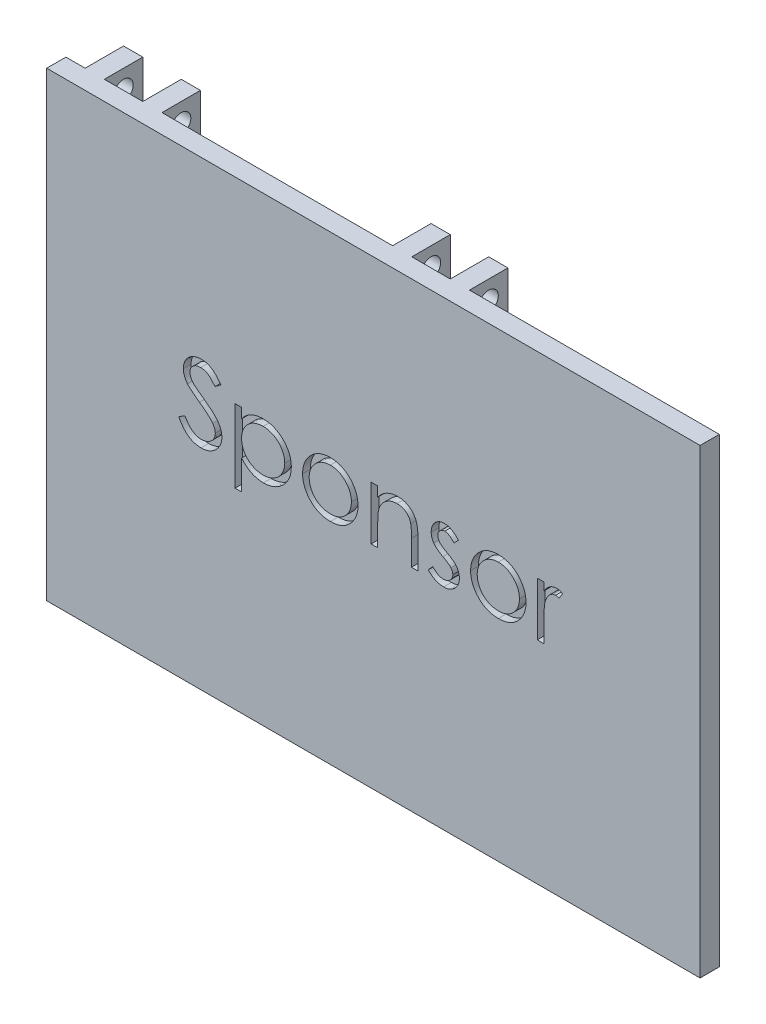
from build123d import *

# Parameters (mm, degrees)
ESQUISSE1_W             = 170
ESQUISSE1_H             = 120
BASE_DEPTH              = 5
ESQUISSE2_W             = 5
ESQUISSE2_H             = 10
BOSS_TIGE_DEPTH         = 10
VIDE_SPONSOR_DEPTH      = 2
ESQUISSE5_R             = 2.5
ENL_V_MAT_EXTRU_3_DEPTH = 122.346611131


with BuildPart() as part:
    # Esquisse1 → BASE (new body)
    with BuildSketch(Plane.XY):
        Rectangle(ESQUISSE1_W, ESQUISSE1_H)
    extrude(amount=BASE_DEPTH)

    # Esquisse2 → BOSS TIGE (add)
    with BuildSketch(Plane(origin=(0, 60, 0), x_dir=(1, 0, 0), z_dir=(0, 1, 0))):
        with Locations((17.5, 5)):
            Rectangle(ESQUISSE2_W, ESQUISSE2_H)
        with Locations((2.5, 5)):
            Rectangle(ESQUISSE2_W, ESQUISSE2_H)
        with Locations((-62.5, 5)):
            Rectangle(ESQUISSE2_W, ESQUISSE2_H)
        with Locations((-77.5, 5)):
            Rectangle(ESQUISSE2_W, ESQUISSE2_H)
    extrude(amount=-BOSS_TIGE_DEPTH)

    # Esquisse4 → VIDE SPONSOR (cut)
    # profile 1 of 7: a face of its own
    with BuildSketch(Plane.XY.offset(5)):
        with BuildLine():
            Line((-50.657804234, -1.320890287), (-49.0474076, -0.355415527))
            add(Edge.make_bspline(
                [(-49.0474076, -0.355415527), (-48.897629765, -0.606137394), (-48.610661215, -1.086510815), (-48.131954532, -1.735615292), (-47.635931115, -2.287315031), (-47.118917743, -2.738400566), (-46.584070225, -3.093540935), (-46.027897018, -3.345013082), (-45.452272363, -3.50185432), (-45.060529134, -3.520904791), (-44.864955676, -3.530415527)],
                knots=[0, 0, 0, 0, 1.272034388, 2.437168799, 3.508375237, 4.49857839, 5.41946034, 6.295179144, 7.148887113, 8, 8, 8, 8], degree=3))
            add(Edge.make_bspline(
                [(-44.864955676, -3.530415527), (-44.697931479, -3.525763667), (-44.366805614, -3.516541342), (-43.87933112, -3.427927263), (-43.405901596, -3.291789818), (-42.956274582, -3.096821605), (-42.536654166, -2.860936419), (-42.168680581, -2.576023653), (-41.850566737, -2.257038447), (-41.590348556, -1.901169998), (-41.390704364, -1.518443804), (-41.237258963, -1.125600411), (-41.152105062, -0.716468633), (-41.13927759, -0.441003113), (-41.132804234, -0.301990046)],
                knots=[0, 0, 0, 0, 1.095163259, 2.171163733, 3.241058638, 4.321873601, 5.38011039, 6.391990106, 7.366004449, 8.327778327, 9.272591725, 10.192022065, 11.087607919, 12, 12, 12, 12], degree=3))
            add(Edge.make_bspline(
                [(-41.132804234, -0.301990046), (-41.140828697, -0.143380564), (-41.157141256, 0.179049335), (-41.295016884, 0.654753161), (-41.511910641, 1.125519863), (-41.712004459, 1.416719609), (-41.815887167, 1.567901781)],
                knots=[0, 0, 0, 0, 0.938893495, 1.908633276, 2.914225137, 4, 4, 4, 4], degree=3))
            add(Edge.make_bspline(
                [(-41.815887167, 1.567901781), (-41.901180081, 1.677013778), (-42.080241886, 1.906080767), (-42.388076347, 2.247049834), (-42.749297626, 2.598758658), (-43.151544118, 2.974637239), (-43.609468502, 3.357203675), (-44.108728259, 3.764701017), (-44.66207012, 4.181632457), (-45.050143094, 4.461245993), (-45.250382359, 4.605521973)],
                knots=[0, 0, 0, 0, 0.722233717, 1.516239348, 2.393582979, 3.351407094, 4.387010283, 5.505090956, 6.712668013, 8, 8, 8, 8], degree=3))
            add(Edge.make_bspline(
                [(-45.250382359, 4.605521973), (-45.45081011, 4.748280428), (-45.834012707, 5.021223724), (-46.369908705, 5.42630447), (-46.849122139, 5.796657532), (-47.269523072, 6.135769369), (-47.630926592, 6.443685975), (-47.936180586, 6.717450472), (-48.177509018, 6.96446671), (-48.311705822, 7.124711728), (-48.371956878, 7.19665779)],
                knots=[0, 0, 0, 0, 1.452282411, 2.77665338, 3.964542531, 5.026858415, 5.96415736, 6.766646006, 7.446254459, 8, 8, 8, 8], degree=3))
            add(Edge.make_bspline(
                [(-48.371956878, 7.19665779), (-48.456171732, 7.308786291), (-48.621791543, 7.529302036), (-48.840409373, 7.87397019), (-49.026223959, 8.226793963), (-49.171887509, 8.588721455), (-49.294548929, 8.954671568), (-49.377051381, 9.329419062), (-49.428711698, 9.7112824), (-49.434002082, 9.968258739), (-49.436650388, 10.096898175)],
                knots=[0, 0, 0, 0, 1.068054152, 2.10047183, 3.106115577, 4.101338837, 5.06977816, 6.043150881, 7.020423561, 8, 8, 8, 8], degree=3))
            add(Edge.make_bspline(
                [(-49.436650388, 10.096898175), (-49.429546322, 10.298445948), (-49.415490034, 10.697233552), (-49.296615219, 11.279787072), (-49.108984183, 11.835973143), (-48.846122008, 12.360285388), (-48.50726413, 12.839071655), (-48.115128184, 13.277839349), (-47.648068523, 13.64669406), (-47.135609245, 13.968976835), (-46.574688134, 14.221231085), (-45.986909074, 14.411518706), (-45.371337868, 14.519337666), (-44.954397949, 14.534810429), (-44.742840292, 14.542661396)],
                knots=[0, 0, 0, 0, 1.005424448, 1.989358655, 2.955360095, 3.929531133, 4.905563448, 5.876582895, 6.856512386, 7.866279853, 8.892233794, 9.918561126, 10.94386622, 12, 12, 12, 12], degree=3))
            add(Edge.make_bspline(
                [(-44.742840292, 14.542661396), (-44.518354546, 14.534918651), (-44.071924046, 14.519520802), (-43.415247601, 14.385639953), (-42.783001416, 14.164112011), (-42.274403075, 13.912713744), (-41.876351902, 13.661627038), (-41.572788885, 13.432919138), (-41.265172474, 13.169620332), (-40.951021347, 12.871029293), (-40.635658615, 12.534406262), (-40.314402397, 12.162056655), (-39.986501448, 11.756255973), (-39.775558838, 11.466562618), (-39.667419619, 11.318052021)],
                knots=[0, 0, 0, 0, 1.286793592, 2.559021753, 3.825965368, 5.121522368, 5.803751409, 6.523245864, 7.299691795, 8.125521123, 9.008227632, 9.944561021, 10.946284179, 12, 12, 12, 12], degree=3))
            Line((-39.667419619, 11.318052021), (-41.212942455, 10.14650755))
            add(Edge.make_bspline(
                [(-41.212942455, 10.14650755), (-41.306265316, 10.266733136), (-41.485983327, 10.498259506), (-41.758830963, 10.822497667), (-42.015998603, 11.118678791), (-42.269365779, 11.375936131), (-42.505551116, 11.608357742), (-42.734788161, 11.807347276), (-42.953777987, 11.974854445), (-43.229822886, 12.15361725), (-43.576629324, 12.330817648), (-44.011973729, 12.480763344), (-44.466921883, 12.570870181), (-44.776781734, 12.582783984), (-44.93364558, 12.588815242)],
                knots=[0, 0, 0, 0, 1.181633172, 2.275549214, 3.290209073, 4.226197932, 5.078386478, 5.862611352, 6.581680152, 7.217281963, 8.414376989, 9.595101626, 10.782541182, 12, 12, 12, 12], degree=3))
            add(Edge.make_bspline(
                [(-44.93364558, 12.588815242), (-45.130440367, 12.582220133), (-45.509940573, 12.569502085), (-46.048730287, 12.43060045), (-46.533655793, 12.211896325), (-46.950320469, 11.905381944), (-47.29723173, 11.542229113), (-47.548177155, 11.124332773), (-47.699217336, 10.662874267), (-47.717648373, 10.340974681), (-47.727035003, 10.177036396)],
                knots=[0, 0, 0, 0, 1.14458467, 2.207223713, 3.21896685, 4.227309161, 5.202851033, 6.127160689, 7.046193047, 8, 8, 8, 8], degree=3))
            add(Edge.make_bspline(
                [(-47.727035003, 10.177036396), (-47.724895271, 10.074974777), (-47.720612308, 9.870684649), (-47.660878052, 9.56887048), (-47.584137419, 9.267818762), (-47.462529666, 8.968882989), (-47.294643085, 8.666835121), (-47.074179199, 8.356473949), (-46.796521029, 8.035063935), (-46.583830433, 7.826018086), (-46.471536205, 7.715648175)],
                knots=[0, 0, 0, 0, 0.858281714, 1.717966888, 2.583508476, 3.4729293, 4.427298488, 5.488583878, 6.674047936, 8, 8, 8, 8], degree=3))
            add(Edge.make_bspline(
                [(-46.471536205, 7.715648175), (-46.42983645, 7.67843522), (-46.330767376, 7.590025758), (-46.149651266, 7.445287773), (-45.910476892, 7.26674697), (-45.619489769, 7.045836004), (-45.271324557, 6.789578332), (-44.865942973, 6.501250528), (-44.407863773, 6.17149253), (-44.082805916, 5.940946488), (-43.910929234, 5.819043608)],
                knots=[0, 0, 0, 0, 0.420754252, 0.999615792, 1.744751191, 2.668019286, 3.750313428, 4.999500688, 6.413464383, 8, 8, 8, 8], degree=3))
            add(Edge.make_bspline(
                [(-43.910929234, 5.819043608), (-43.704177335, 5.668595636), (-43.303830936, 5.377273992), (-42.73419468, 4.939582933), (-42.217701239, 4.511514364), (-41.752537231, 4.09580196), (-41.3341072, 3.695599054), (-40.967053321, 3.306090887), (-40.647635546, 2.930067984), (-40.303760086, 2.447980108), (-39.952381097, 1.855900206), (-39.650620892, 1.130485793), (-39.460347601, 0.402251535), (-39.435465495, -0.08720739), (-39.42318885, -0.328702787)],
                knots=[0, 0, 0, 0, 1.163667725, 2.253281268, 3.268753668, 4.215851969, 5.092017293, 5.902905408, 6.650798638, 7.335211899, 8.59617414, 9.77448103, 10.901945474, 12, 12, 12, 12], degree=3))
            add(Edge.make_bspline(
                [(-39.42318885, -0.328702787), (-39.426765558, -0.499490745), (-39.433849519, -0.837750076), (-39.515279635, -1.334438423), (-39.634585242, -1.816843585), (-39.814402186, -2.27900264), (-40.033875376, -2.729370562), (-40.312365954, -3.156133563), (-40.635169209, -3.568736961), (-41.005467273, -3.956178535), (-41.410665684, -4.311848545), (-41.838929793, -4.628236722), (-42.290960565, -4.892042883), (-42.764305803, -5.107312466), (-43.259074235, -5.275679183), (-43.775099459, -5.397669228), (-44.313232084, -5.472539597), (-44.678994705, -5.480310699), (-44.864955676, -5.484261681)],
                knots=[0, 0, 0, 0, 0.983748083, 1.948392443, 2.894712957, 3.844097841, 4.80183111, 5.778335162, 6.776009319, 7.81870978, 8.863265674, 9.881300176, 10.883814829, 11.87499822, 12.874611388, 13.892143829, 14.928324115, 16, 16, 16, 16], degree=3))
            add(Edge.make_bspline(
                [(-44.864955676, -5.484261681), (-45.008839472, -5.481479392), (-45.294794994, -5.475949856), (-45.717756603, -5.427066029), (-46.13217351, -5.35790308), (-46.532845531, -5.248098499), (-46.924934871, -5.11487381), (-47.306736248, -4.950835171), (-47.678434698, -4.754254403), (-48.042113256, -4.529491483), (-48.396846978, -4.267920045), (-48.739308653, -3.9632643), (-49.080734649, -3.623926623), (-49.411047477, -3.240691985), (-49.736928448, -2.819751848), (-50.051952363, -2.357167864), (-50.362639998, -1.855459696), (-50.557578473, -1.502408301), (-50.657804234, -1.320890287)],
                knots=[0, 0, 0, 0, 0.915332311, 1.819136955, 2.706846663, 3.586547465, 4.459518054, 5.340707479, 6.227863349, 7.133153174, 8.059268498, 9.028702269, 10.047606654, 11.120612155, 12.245963614, 13.433783089, 14.680604001, 16, 16, 16, 16], degree=3))
        make_face()
    # profile 2 of 7: a face of its own
    with BuildSketch(Plane.XY.offset(5)):
        with BuildLine():
            Line((-36.00395808, 8.925353704), (-34.294342696, 8.925353704))
            Line((-34.294342696, 8.925353704), (-34.294342696, 6.34948231))
            add(Edge.make_bspline(
                [(-34.294342696, 6.34948231), (-34.112782675, 6.583186261), (-33.75995711, 7.037343121), (-33.151854413, 7.625117963), (-32.509995639, 8.12082783), (-31.817863351, 8.50935276), (-31.08621441, 8.802291751), (-30.318051368, 9.018805613), (-29.506854662, 9.146394211), (-28.952246826, 9.16175211), (-28.669402792, 9.169584473)],
                knots=[0, 0, 0, 0, 1.0828784, 2.104357462, 3.088488658, 4.04616522, 5.001424249, 5.969181776, 6.964304535, 8, 8, 8, 8], degree=3))
            add(Edge.make_bspline(
                [(-28.669402792, 9.169584473), (-28.42234278, 9.162437028), (-27.934015688, 9.148309727), (-27.215214399, 9.052662102), (-26.523016955, 8.888735804), (-25.861339404, 8.652510822), (-25.223093292, 8.360471764), (-24.617727291, 7.991897613), (-24.035812081, 7.565143918), (-23.491982538, 7.074023211), (-22.989490523, 6.542646504), (-22.554899166, 5.971025106), (-22.18003923, 5.377957314), (-21.877033759, 4.754248926), (-21.639679754, 4.104811404), (-21.470871294, 3.42702089), (-21.370408977, 2.723390414), (-21.356930005, 2.244948464), (-21.350111926, 2.002937838)],
                knots=[0, 0, 0, 0, 1.041296284, 2.058176809, 3.050446431, 4.034000596, 5.01514041, 6.003636468, 7.015969324, 8.052561599, 9.08815499, 10.094063707, 11.074456064, 12.040834395, 13.011057502, 13.983766392, 14.980127149, 16, 16, 16, 16], degree=3))
            add(Edge.make_bspline(
                [(-21.350111926, 2.002937838), (-21.356782069, 1.755819559), (-21.369936554, 1.26846665), (-21.471962943, 0.552801164), (-21.635013929, -0.135651542), (-21.869373469, -0.795746363), (-22.172222141, -1.427028807), (-22.540728391, -2.02904362), (-22.975539019, -2.601597919), (-23.472478014, -3.136918704), (-24.011608995, -3.630037821), (-24.587885045, -4.061319314), (-25.192362911, -4.423494514), (-25.821949992, -4.726024622), (-26.482035968, -4.954037796), (-27.169541093, -5.118508968), (-27.884091062, -5.219933866), (-28.370144475, -5.233280527), (-28.615977311, -5.240030912)],
                knots=[0, 0, 0, 0, 1.038740735, 2.04854663, 3.033179607, 4.009277356, 4.987731542, 5.972001279, 6.972200261, 8.005528982, 9.039189865, 10.040446548, 11.026516639, 11.997840187, 12.972163198, 13.956796175, 14.96660207, 16, 16, 16, 16], degree=3))
            add(Edge.make_bspline(
                [(-28.615977311, -5.240030912), (-28.892624524, -5.232983458), (-29.439083876, -5.219062672), (-30.238082625, -5.077987025), (-31.007032348, -4.867147418), (-31.737413837, -4.558542896), (-32.435012931, -4.165266445), (-33.095883588, -3.685695181), (-33.7235362, -3.120832067), (-34.10131815, -2.692306039), (-34.294342696, -2.473354229)],
                knots=[0, 0, 0, 0, 1.014726462, 2.004382257, 2.969841629, 3.936926163, 4.907207904, 5.903978561, 6.929055279, 8, 8, 8, 8], degree=3))
            Line((-34.294342696, -2.473354229), (-34.294342696, -10.124646296))
            Line((-34.294342696, -10.124646296), (-36.00395808, -10.124646296))
            Line((-36.00395808, -10.124646296), (-36.00395808, 8.925353704))
        make_face()
        with BuildLine():
            add(Edge.make_bspline(
                [(-28.684667215, 7.459969088), (-28.878321691, 7.456484254), (-29.259577438, 7.449623515), (-29.818407659, 7.36812245), (-30.356681344, 7.249807031), (-30.86897368, 7.070672259), (-31.360194892, 6.85078729), (-31.826561561, 6.576020915), (-32.267746321, 6.251343569), (-32.682639158, 5.882974569), (-33.057452227, 5.477075195), (-33.389264735, 5.043890119), (-33.667978781, 4.583967931), (-33.899311205, 4.101592743), (-34.075351073, 3.592983406), (-34.200295776, 3.06103658), (-34.278838125, 2.50517003), (-34.289119341, 2.126586624), (-34.294342696, 1.934247935)],
                knots=[0, 0, 0, 0, 1.05670511, 2.080379991, 3.077984906, 4.06214886, 5.038337365, 6.01289324, 7.01187578, 8.025460281, 9.038092164, 10.024533457, 11.000252242, 11.969694649, 12.940728589, 13.933144304, 14.949937299, 16, 16, 16, 16], degree=3))
            add(Edge.make_bspline(
                [(-34.294342696, 1.934247935), (-34.285683893, 1.681764065), (-34.268720566, 1.187126781), (-34.130812892, 0.464401774), (-33.90637524, -0.219502237), (-33.587811813, -0.858825881), (-33.18532573, -1.446561026), (-32.700377193, -1.972834184), (-32.137354165, -2.434337258), (-31.505617022, -2.823072939), (-30.828405139, -3.1386937), (-30.121998961, -3.364649617), (-29.396112966, -3.503835603), (-28.905339683, -3.521507575), (-28.657954475, -3.530415527)],
                knots=[0, 0, 0, 0, 1.03728447, 2.032128127, 3.01272805, 3.987917167, 4.958271349, 5.931593992, 6.91984656, 7.941419022, 8.973179163, 9.983609215, 10.983593296, 12, 12, 12, 12], degree=3))
            add(Edge.make_bspline(
                [(-28.657954475, -3.530415527), (-28.415552652, -3.52194439), (-27.934428612, -3.505130706), (-27.22599655, -3.35959857), (-26.537526075, -3.137284937), (-25.883402565, -2.81311078), (-25.269320439, -2.415836321), (-24.714793697, -1.939259569), (-24.230341782, -1.386864307), (-23.817422936, -0.77177517), (-23.484692994, -0.112234867), (-23.23470126, 0.570198119), (-23.090418882, 1.273118208), (-23.069971219, 1.746634331), (-23.059727311, 1.98385731)],
                knots=[0, 0, 0, 0, 1.00104056, 1.986885549, 2.97790532, 3.984399681, 4.995088187, 5.994304198, 6.996462723, 8.023150851, 9.048424203, 10.043036403, 11.019596776, 12, 12, 12, 12], degree=3))
            add(Edge.make_bspline(
                [(-23.059727311, 1.98385731), (-23.06764522, 2.22255375), (-23.083419348, 2.698086946), (-23.238796796, 3.398925032), (-23.472295246, 4.084115302), (-23.812795229, 4.73464858), (-24.216662138, 5.348461801), (-24.705142222, 5.890319343), (-25.252781805, 6.364776861), (-25.866132826, 6.756746449), (-26.524394285, 7.068543215), (-27.217351184, 7.296509878), (-27.941488506, 7.433527), (-28.434761883, 7.451077527), (-28.684667215, 7.459969088)],
                knots=[0, 0, 0, 0, 0.983928682, 1.960191568, 2.949917689, 3.96440592, 4.982380491, 5.975291189, 6.965713506, 7.964880129, 8.970154049, 9.96478489, 10.968906225, 12, 12, 12, 12], degree=3))
        make_face(mode=Mode.SUBTRACT)
    # profile 3 of 7: a face of its own
    with BuildSketch(Plane.XY.offset(5)):
        with BuildLine():
            add(Edge.make_bspline(
                [(-11.206902792, 9.169584473), (-10.94569315, 9.164022466), (-10.433524878, 9.153116728), (-9.683456242, 9.036558129), (-8.967474859, 8.858318903), (-8.282838585, 8.611912258), (-7.638315605, 8.28162907), (-7.024517833, 7.887515643), (-6.443128114, 7.420613241), (-6.094659912, 7.059435754), (-5.917780196, 6.876104906)],
                knots=[0, 0, 0, 0, 1.054011418, 2.066658804, 3.057071809, 4.030435133, 4.997543892, 5.974964718, 6.972108034, 8, 8, 8, 8], degree=3))
            add(Edge.make_bspline(
                [(-5.917780196, 6.876104906), (-5.765478417, 6.700768783), (-5.463822319, 6.353489775), (-5.077021764, 5.790395653), (-4.743801558, 5.207247391), (-4.47675887, 4.596301227), (-4.266201813, 3.962890517), (-4.116709952, 3.304838142), (-4.027790349, 2.623597367), (-4.015799914, 2.16093362), (-4.009727311, 1.926615723)],
                knots=[0, 0, 0, 0, 1.025258237, 2.030674902, 3.01204498, 3.988269485, 4.97094183, 5.956517959, 6.965070386, 8, 8, 8, 8], degree=3))
            add(Edge.make_bspline(
                [(-4.009727311, 1.926615723), (-4.01506859, 1.690939695), (-4.025623206, 1.225232872), (-4.125464889, 0.539327467), (-4.280755514, -0.125761497), (-4.502997376, -0.76724953), (-4.787975085, -1.38709749), (-5.13572297, -1.982598037), (-5.548681343, -2.554926077), (-6.016788812, -3.099221797), (-6.534142595, -3.600869337), (-7.095389059, -4.038084633), (-7.689498871, -4.412670358), (-8.32437198, -4.714402849), (-8.99421073, -4.952308504), (-9.700459915, -5.119404307), (-10.442022369, -5.2204329), (-10.948356245, -5.233406349), (-11.206902792, -5.240030912)],
                knots=[0, 0, 0, 0, 0.998656419, 1.973391657, 2.932242238, 3.890759089, 4.846373663, 5.82037756, 6.809684879, 7.83454468, 8.860553229, 9.859544525, 10.845671541, 11.83227036, 12.833544569, 13.85385346, 14.904124723, 16, 16, 16, 16], degree=3))
            add(Edge.make_bspline(
                [(-11.206902792, -5.240030912), (-11.466716051, -5.233384115), (-11.975573445, -5.220366028), (-12.719753432, -5.119796818), (-13.427268358, -4.952385513), (-14.097984015, -4.713621017), (-14.735586682, -4.412660714), (-15.333138902, -4.03921709), (-15.894841299, -3.600739673), (-16.412304528, -3.09925693), (-16.880382652, -2.554917025), (-17.293348597, -1.982600387), (-17.641094515, -1.387096878), (-17.926072739, -0.767249693), (-18.148314464, -0.125761453), (-18.303605125, 0.539327455), (-18.403446799, 1.225232875), (-18.414001416, 1.690939696), (-18.419342696, 1.926615723)],
                knots=[0, 0, 0, 0, 1.099876186, 2.154163076, 3.173186993, 4.173200201, 5.163417411, 6.152872554, 7.150605724, 8.17532212, 9.198891216, 10.186952605, 11.159729845, 12.11414092, 13.071450619, 14.029093627, 15.002601286, 16, 16, 16, 16], degree=3))
            add(Edge.make_bspline(
                [(-18.419342696, 1.926615723), (-18.413228678, 2.159660066), (-18.401123973, 2.621047813), (-18.312293774, 3.301007957), (-18.163385059, 3.957946604), (-17.952575602, 4.588912409), (-17.683071491, 5.197181282), (-17.354533624, 5.781770433), (-16.963787467, 6.342318319), (-16.663331131, 6.689148497), (-16.511289811, 6.864656588)],
                knots=[0, 0, 0, 0, 1.031353054, 2.041901799, 3.029428768, 4.008703097, 4.981709435, 5.96992636, 6.972712378, 8, 8, 8, 8], degree=3))
            add(Edge.make_bspline(
                [(-16.511289811, 6.864656588), (-16.334676766, 7.049577329), (-15.987336135, 7.413256504), (-15.403052346, 7.878797814), (-14.790764548, 8.281112445), (-14.139118879, 8.604832989), (-13.455045037, 8.859768349), (-12.735394589, 9.037017796), (-11.982780712, 9.152696771), (-11.468106203, 9.163899139), (-11.206902792, 9.169584473)],
                knots=[0, 0, 0, 0, 1.027980169, 2.021703884, 2.998553061, 3.971491411, 4.943284454, 5.930300938, 6.949603206, 8, 8, 8, 8], degree=3))
        make_face()
        with BuildLine():
            add(Edge.make_bspline(
                [(-11.214535003, 7.459969088), (-11.399252574, 7.454718954), (-11.76391926, 7.444354216), (-12.300691571, 7.365520392), (-12.817437266, 7.240620405), (-13.315136717, 7.063161185), (-13.792111556, 6.834022892), (-14.248818446, 6.552581674), (-14.686600726, 6.222565154), (-15.096894528, 5.844489756), (-15.47344397, 5.431491228), (-15.802616957, 4.991445161), (-16.082516464, 4.53148919), (-16.315689329, 4.051145012), (-16.489355596, 3.545544874), (-16.615483047, 3.020414581), (-16.694242499, 2.474684243), (-16.704509788, 2.103693557), (-16.709727311, 1.915167406)],
                knots=[0, 0, 0, 0, 1.021534396, 2.016698045, 2.994645724, 3.958388632, 4.93408049, 5.916473867, 6.921342795, 7.962252576, 8.998418191, 10.008913653, 10.997312074, 11.973003931, 12.956656626, 13.948281152, 14.957379055, 16, 16, 16, 16], degree=3))
            add(Edge.make_bspline(
                [(-16.709727311, 1.915167406), (-16.7009816, 1.671588515), (-16.683622998, 1.188129965), (-16.542461211, 0.476143712), (-16.306315887, -0.207380369), (-15.987433694, -0.85843527), (-15.587894132, -1.460808669), (-15.117157383, -1.997863463), (-14.580275586, -2.461517665), (-13.983648635, -2.84622341), (-13.33946299, -3.151892938), (-12.657710728, -3.368513077), (-11.946652093, -3.509329003), (-11.460709828, -3.52332517), (-11.214535003, -3.530415527)],
                knots=[0, 0, 0, 0, 1.016792936, 2.018143844, 3.017858371, 4.030088057, 5.03801393, 6.028138512, 7.003788237, 7.991172063, 8.984598303, 9.972568034, 10.972917682, 12, 12, 12, 12], degree=3))
            add(Edge.make_bspline(
                [(-11.214535003, -3.530415527), (-10.968374338, -3.523283859), (-10.482460023, -3.509206144), (-9.77238936, -3.369222282), (-9.092500456, -3.150943786), (-8.448983904, -2.846567186), (-7.852628534, -2.460056757), (-7.31188546, -2.000481619), (-6.845168019, -1.459386228), (-6.446023684, -0.857637393), (-6.12191927, -0.208389705), (-5.886879272, 0.476269866), (-5.745378126, 1.188097837), (-5.728065329, 1.671577751), (-5.719342696, 1.915167406)],
                knots=[0, 0, 0, 0, 1.02726834, 2.027799167, 3.010890988, 4.004497153, 4.992059811, 5.971914811, 6.958719428, 7.966827853, 8.981595046, 9.981490638, 10.983022906, 12, 12, 12, 12], degree=3))
            add(Edge.make_bspline(
                [(-5.719342696, 1.915167406), (-5.724558423, 2.103694684), (-5.734822177, 2.474687587), (-5.81360734, 3.020401798), (-5.939639634, 3.545591774), (-6.11365658, 4.050971964), (-6.345816284, 4.53273288), (-6.6311134, 4.99009468), (-6.958942267, 5.433015595), (-7.340035454, 5.843154697), (-7.749900982, 6.222712539), (-8.18786069, 6.552709644), (-8.643890359, 6.832785985), (-9.119479502, 7.065121095), (-9.617242763, 7.239005904), (-10.133264423, 7.36624157), (-10.667746517, 7.444021069), (-11.031106452, 7.454619082), (-11.214535003, 7.459969088)],
                knots=[0, 0, 0, 0, 1.042956736, 2.052379634, 3.044323526, 4.02829302, 5.004299113, 5.996692471, 7.007513377, 8.048758398, 9.090003419, 10.095195979, 11.07790575, 12.047570684, 13.018257071, 13.989683339, 14.985167495, 16, 16, 16, 16], degree=3))
        make_face(mode=Mode.SUBTRACT)
    # profile 4 of 7: a face of its own
    with BuildSketch(Plane.XY.offset(5)):
        with BuildLine():
            Line((-0.590496542, 8.925353704), (1.119118843, 8.925353704))
            Line((1.119118843, 8.925353704), (1.119118843, 6.414356108))
            add(Edge.make_bspline(
                [(1.119118843, 6.414356108), (1.3016594, 6.642100071), (1.655885719, 7.084045176), (2.245806162, 7.664910018), (2.869252248, 8.143583314), (3.522406009, 8.52514825), (4.206154107, 8.812784886), (4.916328691, 9.020516597), (5.657181591, 9.145075449), (6.160996598, 9.161350846), (6.41587365, 9.169584473)],
                knots=[0, 0, 0, 0, 1.12780773, 2.188550248, 3.19190651, 4.159438251, 5.104880172, 6.052711206, 7.014878035, 8, 8, 8, 8], degree=3))
            add(Edge.make_bspline(
                [(6.41587365, 9.169584473), (6.67348753, 9.160085624), (7.177700034, 9.141494084), (7.911822053, 8.994446094), (8.597477239, 8.743284062), (9.232220821, 8.399229793), (9.804413225, 7.971385988), (10.306924203, 7.472941204), (10.722558449, 6.899611951), (11.001218382, 6.367718773), (11.184782264, 5.895884049), (11.300346844, 5.491769595), (11.398486901, 5.041546515), (11.483568272, 4.546575324), (11.541137981, 4.003388031), (11.586543882, 3.414211307), (11.619085061, 2.779235997), (11.620376145, 2.34007021), (11.62104192, 2.113604906)],
                knots=[0, 0, 0, 0, 1.235846778, 2.418850247, 3.575807741, 4.728682307, 5.871620074, 6.994088408, 8.11269785, 9.256955736, 9.865816715, 10.540099792, 11.271859618, 12.076849838, 12.949306005, 13.892391288, 14.913166135, 16, 16, 16, 16], degree=3))
            Line((11.62104192, 2.113604906), (11.62104192, -4.995800142))
            Line((11.62104192, -4.995800142), (9.911426535, -4.995800142))
            Line((9.911426535, -4.995800142), (9.911426535, 1.552637358))
            add(Edge.make_bspline(
                [(9.911426535, 1.552637358), (9.910374931, 1.742170951), (9.908363393, 2.104716458), (9.902018944, 2.623796427), (9.886725568, 3.094530518), (9.865235465, 3.515793332), (9.833781028, 3.887180357), (9.801000705, 4.209447992), (9.760914189, 4.482187073), (9.72519319, 4.646371307), (9.709172929, 4.720005146)],
                knots=[0, 0, 0, 0, 1.430800155, 2.736877192, 3.918605307, 4.986035426, 5.920637409, 6.731861385, 7.431261377, 8, 8, 8, 8], degree=3))
            add(Edge.make_bspline(
                [(9.709172929, 4.720005146), (9.651339679, 4.936147453), (9.540028566, 5.35215452), (9.264979315, 5.916439211), (8.917647845, 6.396489347), (8.49366098, 6.789336932), (7.997114154, 7.095066772), (7.429385277, 7.30719644), (6.795952961, 7.439872991), (6.350431249, 7.453083523), (6.1182174, 7.459969088)],
                knots=[0, 0, 0, 0, 1.084156227, 2.086665306, 3.027808233, 3.945421172, 4.874247719, 5.839848303, 6.874090471, 8, 8, 8, 8], degree=3))
            add(Edge.make_bspline(
                [(6.1182174, 7.459969088), (5.980689008, 7.457378263), (5.708523874, 7.452251087), (5.304936169, 7.400809022), (4.91346317, 7.316670856), (4.530176032, 7.203085843), (4.162740755, 7.047081207), (3.799352256, 6.870028492), (3.453694011, 6.649330366), (3.118395521, 6.40336427), (2.806450096, 6.130790299), (2.516191569, 5.843165179), (2.257448915, 5.536865107), (2.023032269, 5.216825393), (1.820676292, 4.878650675), (1.64403877, 4.525603521), (1.494165917, 4.157219254), (1.419692977, 3.901540706), (1.382430141, 3.773610915)],
                knots=[0, 0, 0, 0, 1.023777757, 2.026029729, 3.023749952, 4.003683103, 4.997618607, 5.993177895, 7.010360494, 8.046726602, 9.087585522, 10.09234134, 11.086953743, 12.070360549, 13.043493632, 14.017870808, 15.008233677, 16, 16, 16, 16], degree=3))
            add(Edge.make_bspline(
                [(1.382430141, 3.773610915), (1.360987196, 3.67969331), (1.314307028, 3.475239597), (1.263888864, 3.139717828), (1.218127632, 2.751587821), (1.179826471, 2.311302496), (1.156392704, 1.817320347), (1.130841773, 1.271751001), (1.121539598, 0.672419015), (1.119948357, 0.255160373), (1.119118843, 0.037643367)],
                knots=[0, 0, 0, 0, 0.615963638, 1.340920617, 2.168419149, 3.115676021, 4.16674242, 5.331190069, 6.6087489, 8, 8, 8, 8], degree=3))
            Line((1.119118843, 0.037643367), (1.119118843, -4.995800142))
            Line((1.119118843, -4.995800142), (-0.590496542, -4.995800142))
            Line((-0.590496542, -4.995800142), (-0.590496542, 8.925353704))
        make_face()
    # profile 5 of 7: a face of its own
    with BuildSketch(Plane.XY.offset(5)):
        with BuildLine():
            Line((22.122964997, 7.189025579), (20.962868843, 5.994584473))
            add(Edge.make_bspline(
                [(20.962868843, 5.994584473), (20.862771959, 6.110588884), (20.669796952, 6.334231731), (20.363737034, 6.633246336), (20.058808563, 6.884363104), (19.759185735, 7.096374684), (19.457334299, 7.256662182), (19.156796501, 7.373655645), (18.857261168, 7.446055473), (18.657040033, 7.455386918), (18.558722208, 7.459969088)],
                knots=[0, 0, 0, 0, 1.26578478, 2.440284043, 3.530471711, 4.527705817, 5.468200915, 6.346673037, 7.188140097, 8, 8, 8, 8], degree=3))
            add(Edge.make_bspline(
                [(18.558722208, 7.459969088), (18.438220672, 7.454118708), (18.201090703, 7.442605988), (17.861315892, 7.327688603), (17.545898918, 7.15129247), (17.272901641, 6.901092036), (17.041647269, 6.613903659), (16.872844233, 6.29279509), (16.769615094, 5.947456453), (16.756526481, 5.707808227), (16.749888074, 5.586261156)],
                knots=[0, 0, 0, 0, 0.99966794, 1.967205029, 2.953328237, 3.988086729, 5.028030931, 6.008226631, 6.989793394, 8, 8, 8, 8], degree=3))
            add(Edge.make_bspline(
                [(16.749888074, 5.586261156), (16.755934066, 5.476249887), (16.768009007, 5.256537469), (16.861880219, 4.932426028), (17.011374126, 4.616429863), (17.151093326, 4.422866044), (17.223085189, 4.323130146)],
                knots=[0, 0, 0, 0, 0.960159726, 1.917612774, 2.927026955, 4, 4, 4, 4], degree=3))
            add(Edge.make_bspline(
                [(17.223085189, 4.323130146), (17.266429348, 4.269874051), (17.358681927, 4.156525166), (17.53181113, 3.999205621), (17.727876467, 3.825348512), (17.9636607, 3.651520871), (18.22900558, 3.468468195), (18.529665113, 3.283399443), (18.856097776, 3.082207359), (19.089799402, 2.954602645), (19.211276295, 2.888274377)],
                knots=[0, 0, 0, 0, 0.66740084, 1.420478572, 2.27185888, 3.217733974, 4.268547843, 5.408967954, 6.65319498, 8, 8, 8, 8], degree=3))
            add(Edge.make_bspline(
                [(19.211276295, 2.888274377), (19.359395907, 2.805298549), (19.645514226, 2.645016571), (20.052056287, 2.396225185), (20.421011468, 2.148948433), (20.755505887, 1.905830842), (21.049103447, 1.660070234), (21.31071194, 1.421086585), (21.533806185, 1.181659064), (21.658741129, 1.014383117), (21.718457785, 0.934428223)],
                knots=[0, 0, 0, 0, 1.27191281, 2.456916733, 3.569705269, 4.599008579, 5.553216877, 6.436649441, 7.252746552, 8, 8, 8, 8], degree=3))
            add(Edge.make_bspline(
                [(21.718457785, 0.934428223), (21.817575084, 0.772959944), (22.014836905, 0.4516081), (22.221982613, -0.077537912), (22.342053537, -0.638753647), (22.358720765, -1.022650445), (22.367195766, -1.217855431)],
                knots=[0, 0, 0, 0, 0.995354457, 1.980940102, 2.973342416, 4, 4, 4, 4], degree=3))
            add(Edge.make_bspline(
                [(22.367195766, -1.217855431), (22.363279446, -1.355391784), (22.35556191, -1.626422192), (22.30190586, -2.025573194), (22.209622346, -2.407305572), (22.083926342, -2.775761335), (21.914194256, -3.123880707), (21.715269817, -3.460446576), (21.47646494, -3.778178428), (21.203824739, -4.076659054), (20.90530855, -4.349268622), (20.586867997, -4.588884714), (20.248110933, -4.787953607), (19.891457914, -4.952683557), (19.516098597, -5.083683647), (19.121974294, -5.174375424), (18.710337787, -5.228655738), (18.430412688, -5.236191244), (18.287778699, -5.240030912)],
                knots=[0, 0, 0, 0, 1.032770009, 2.035186124, 3.017557409, 3.978232242, 4.952395191, 5.920591857, 6.910227898, 7.931268572, 8.952309245, 9.941945286, 10.918353717, 11.897095711, 12.887975737, 13.898235213, 14.929059601, 16, 16, 16, 16], degree=3))
            add(Edge.make_bspline(
                [(18.287778699, -5.240030912), (18.095280215, -5.234627786), (17.712957998, -5.223896609), (17.147501099, -5.123170762), (16.594938112, -4.966441546), (16.059450557, -4.750273391), (15.553013851, -4.477310225), (15.08965839, -4.150399197), (14.667774573, -3.780339354), (14.427645112, -3.496696226), (14.307580381, -3.354874662)],
                knots=[0, 0, 0, 0, 1.013940152, 2.01379169, 3.017749504, 4.037548394, 5.051665909, 6.043208538, 7.021604269, 8, 8, 8, 8], degree=3))
            Line((14.307580381, -3.354874662), (15.440963795, -2.065030912))
            add(Edge.make_bspline(
                [(15.440963795, -2.065030912), (15.548582214, -2.181261844), (15.757216792, -2.406593082), (16.090870557, -2.706626993), (16.430392726, -2.958093912), (16.772392949, -3.168424498), (17.121933748, -3.330487764), (17.477056306, -3.444344682), (17.837038299, -3.5175195), (18.078821639, -3.526109865), (18.200008266, -3.530415527)],
                knots=[0, 0, 0, 0, 1.179806542, 2.287233372, 3.337373186, 4.324005949, 5.273901747, 6.200048787, 7.097828587, 8, 8, 8, 8], degree=3))
            add(Edge.make_bspline(
                [(18.200008266, -3.530415527), (18.365024406, -3.522954323), (18.687438262, -3.508376382), (19.14923072, -3.376021924), (19.575616672, -3.168486044), (19.945858024, -2.874110758), (20.261011215, -2.53145257), (20.489220279, -2.145477149), (20.632237748, -1.727512221), (20.649034398, -1.437776402), (20.657580381, -1.29036144)],
                knots=[0, 0, 0, 0, 1.072336372, 2.095165389, 3.102688358, 4.141489647, 5.156069229, 6.117746104, 7.042326257, 8, 8, 8, 8], degree=3))
            add(Edge.make_bspline(
                [(20.657580381, -1.29036144), (20.651667836, -1.168933373), (20.639994308, -0.929189909), (20.548318785, -0.58220591), (20.403468832, -0.253080253), (20.260840674, -0.060459459), (20.188199372, 0.037643367)],
                knots=[0, 0, 0, 0, 1.013901739, 2.00181326, 2.98231254, 4, 4, 4, 4], degree=3))
            add(Edge.make_bspline(
                [(20.188199372, 0.037643367), (20.144534625, 0.086821553), (20.049417036, 0.193949402), (19.874944937, 0.348663045), (19.666037944, 0.515421842), (19.420346486, 0.691398062), (19.137375272, 0.874270471), (18.815977413, 1.06307966), (18.460555834, 1.266793424), (18.209255684, 1.401883263), (18.077892881, 1.472499136)],
                knots=[0, 0, 0, 0, 0.615000592, 1.339693406, 2.178160186, 3.116406724, 4.166410947, 5.330106347, 6.604359322, 8, 8, 8, 8], degree=3))
            add(Edge.make_bspline(
                [(18.077892881, 1.472499136), (17.93612474, 1.551633553), (17.661191072, 1.705100442), (17.271769388, 1.944129393), (16.92044736, 2.187246988), (16.598771376, 2.420815442), (16.314866474, 2.657149436), (16.069851098, 2.896511334), (15.854078737, 3.129247829), (15.734622111, 3.294151687), (15.677562352, 3.37291981)],
                knots=[0, 0, 0, 0, 1.262093308, 2.447601706, 3.550203992, 4.582594899, 5.537233252, 6.418365656, 7.244515135, 8, 8, 8, 8], degree=3))
            add(Edge.make_bspline(
                [(15.677562352, 3.37291981), (15.578880089, 3.531555229), (15.381481075, 3.848881503), (15.189809821, 4.378528526), (15.058059863, 4.936122338), (15.046290283, 5.320860789), (15.040272689, 5.517571252)],
                knots=[0, 0, 0, 0, 0.985009483, 1.970363186, 2.962279964, 4, 4, 4, 4], degree=3))
            add(Edge.make_bspline(
                [(15.040272689, 5.517571252), (15.043180238, 5.646160918), (15.048870723, 5.897829112), (15.094286203, 6.267610406), (15.176972517, 6.618936786), (15.280685739, 6.957084426), (15.424828949, 7.275502967), (15.59707309, 7.57843863), (15.799478931, 7.865472698), (16.032668843, 8.132189746), (16.289063583, 8.37444765), (16.566076544, 8.58562304), (16.857477626, 8.7658162), (17.164500596, 8.916938002), (17.490094884, 9.031245527), (17.831984616, 9.109935009), (18.189477759, 9.162486899), (18.433868173, 9.167184543), (18.558722208, 9.169584473)],
                knots=[0, 0, 0, 0, 1.087655834, 2.128696564, 3.144119009, 4.137814668, 5.115653402, 6.093965665, 7.082169637, 8.081268856, 9.086088321, 10.061021666, 11.022561449, 11.980240094, 12.950172527, 13.934149372, 14.944599409, 16, 16, 16, 16], degree=3))
            add(Edge.make_bspline(
                [(18.558722208, 9.169584473), (18.706724725, 9.163573704), (19.005506132, 9.151439411), (19.453750597, 9.055069867), (19.90133493, 8.896502543), (20.349409164, 8.677502473), (20.794690882, 8.394109906), (21.241096916, 8.051594719), (21.693986338, 7.652210302), (21.976777128, 7.346870232), (22.122964997, 7.189025579)],
                knots=[0, 0, 0, 0, 0.845714091, 1.707292901, 2.609013841, 3.555613372, 4.552488639, 5.621697636, 6.770543573, 8, 8, 8, 8], degree=3))
        make_face()
    # profile 6 of 7: a face of its own
    with BuildSketch(Plane.XY.offset(5)):
        with BuildLine():
            add(Edge.make_bspline(
                [(32.5104049, 9.169584473), (32.771614543, 9.164022466), (33.283782815, 9.153116728), (34.033851451, 9.036558129), (34.749832833, 8.858318903), (35.434469108, 8.611912258), (36.078992087, 8.28162907), (36.692789859, 7.887515643), (37.274179579, 7.420613241), (37.622647781, 7.059435754), (37.799527497, 6.876104906)],
                knots=[0, 0, 0, 0, 1.054011418, 2.066658804, 3.057071809, 4.030435133, 4.997543892, 5.974964718, 6.972108034, 8, 8, 8, 8], degree=3))
            add(Edge.make_bspline(
                [(37.799527497, 6.876104906), (37.951829275, 6.700768783), (38.253485373, 6.353489775), (38.640285928, 5.790395653), (38.973506134, 5.207247391), (39.240548822, 4.596301227), (39.45110588, 3.962890517), (39.600597741, 3.304838142), (39.689517344, 2.623597367), (39.701507778, 2.16093362), (39.707580381, 1.926615723)],
                knots=[0, 0, 0, 0, 1.025258237, 2.030674902, 3.01204498, 3.988269485, 4.97094183, 5.956517959, 6.965070386, 8, 8, 8, 8], degree=3))
            add(Edge.make_bspline(
                [(39.707580381, 1.926615723), (39.702239102, 1.690939695), (39.691684486, 1.225232872), (39.591842803, 0.539327467), (39.436552178, -0.125761497), (39.214310316, -0.76724953), (38.929332607, -1.38709749), (38.581584722, -1.982598037), (38.168626349, -2.554926077), (37.700518881, -3.099221797), (37.183165098, -3.600869337), (36.621918633, -4.038084633), (36.027808821, -4.412670358), (35.392935712, -4.714402849), (34.723096963, -4.952308504), (34.016847778, -5.119404307), (33.275285324, -5.2204329), (32.768951447, -5.233406349), (32.5104049, -5.240030912)],
                knots=[0, 0, 0, 0, 0.998656419, 1.973391657, 2.932242238, 3.890759089, 4.846373663, 5.82037756, 6.809684879, 7.83454468, 8.860553229, 9.859544525, 10.845671541, 11.83227036, 12.833544569, 13.85385346, 14.904124723, 16, 16, 16, 16], degree=3))
            add(Edge.make_bspline(
                [(32.5104049, -5.240030912), (32.250591641, -5.233384115), (31.741734248, -5.220366028), (30.99755426, -5.119796818), (30.290039335, -4.952385513), (29.619323677, -4.713621017), (28.98172101, -4.412660714), (28.384168791, -4.03921709), (27.822466393, -3.600739673), (27.305003164, -3.09925693), (26.836925041, -2.554917025), (26.423959095, -1.982600387), (26.076213177, -1.387096878), (25.791234953, -0.767249693), (25.568993229, -0.125761453), (25.413702567, 0.539327455), (25.313860894, 1.225232875), (25.303306276, 1.690939696), (25.297964997, 1.926615723)],
                knots=[0, 0, 0, 0, 1.099876186, 2.154163076, 3.173186993, 4.173200201, 5.163417411, 6.152872554, 7.150605724, 8.17532212, 9.198891216, 10.186952605, 11.159729845, 12.11414092, 13.071450619, 14.029093627, 15.002601286, 16, 16, 16, 16], degree=3))
            add(Edge.make_bspline(
                [(25.297964997, 1.926615723), (25.304079014, 2.159660066), (25.316183719, 2.621047813), (25.405013918, 3.301007957), (25.553922633, 3.957946604), (25.764732091, 4.588912409), (26.034236201, 5.197181282), (26.362774068, 5.781770433), (26.753520225, 6.342318319), (27.053976562, 6.689148497), (27.206017881, 6.864656588)],
                knots=[0, 0, 0, 0, 1.031353054, 2.041901799, 3.029428768, 4.008703097, 4.981709435, 5.96992636, 6.972712378, 8, 8, 8, 8], degree=3))
            add(Edge.make_bspline(
                [(27.206017881, 6.864656588), (27.382630927, 7.049577329), (27.729971557, 7.413256504), (28.314255347, 7.878797814), (28.926543144, 8.281112445), (29.578188814, 8.604832989), (30.262262655, 8.859768349), (30.981913103, 9.037017796), (31.73452698, 9.152696771), (32.24920149, 9.163899139), (32.5104049, 9.169584473)],
                knots=[0, 0, 0, 0, 1.027980169, 2.021703884, 2.998553061, 3.971491411, 4.943284454, 5.930300938, 6.949603206, 8, 8, 8, 8], degree=3))
        make_face()
        with BuildLine():
            add(Edge.make_bspline(
                [(32.502772689, 7.459969088), (32.318055119, 7.454718954), (31.953388433, 7.444354216), (31.416616122, 7.365520392), (30.899870427, 7.240620405), (30.402170975, 7.063161185), (29.925196137, 6.834022892), (29.468489246, 6.552581674), (29.030706966, 6.222565154), (28.620413164, 5.844489756), (28.243863722, 5.431491228), (27.914690735, 4.991445161), (27.634791228, 4.53148919), (27.401618363, 4.051145012), (27.227952096, 3.545544874), (27.101824645, 3.020414581), (27.023065194, 2.474684243), (27.012797904, 2.103693557), (27.007580381, 1.915167406)],
                knots=[0, 0, 0, 0, 1.021534396, 2.016698045, 2.994645724, 3.958388632, 4.93408049, 5.916473867, 6.921342795, 7.962252576, 8.998418191, 10.008913653, 10.997312074, 11.973003931, 12.956656626, 13.948281152, 14.957379055, 16, 16, 16, 16], degree=3))
            add(Edge.make_bspline(
                [(27.007580381, 1.915167406), (27.016326093, 1.671588515), (27.033684695, 1.188129965), (27.174846482, 0.476143712), (27.410991805, -0.207380369), (27.729873999, -0.85843527), (28.12941356, -1.460808669), (28.600150309, -1.997863463), (29.137032107, -2.461517665), (29.733659058, -2.84622341), (30.377844702, -3.151892938), (31.059596964, -3.368513077), (31.770655599, -3.509329003), (32.256597864, -3.52332517), (32.502772689, -3.530415527)],
                knots=[0, 0, 0, 0, 1.016792936, 2.018143844, 3.017858371, 4.030088057, 5.03801393, 6.028138512, 7.003788237, 7.991172063, 8.984598303, 9.972568034, 10.972917682, 12, 12, 12, 12], degree=3))
            add(Edge.make_bspline(
                [(32.502772689, -3.530415527), (32.748933354, -3.523283859), (33.234847669, -3.509206144), (33.944918332, -3.369222282), (34.624807236, -3.150943786), (35.268323788, -2.846567186), (35.864679158, -2.460056757), (36.405422233, -2.000481619), (36.872139673, -1.459386228), (37.271284009, -0.857637393), (37.595388422, -0.208389705), (37.830428421, 0.476269866), (37.971929567, 1.188097837), (37.989242363, 1.671577751), (37.997964997, 1.915167406)],
                knots=[0, 0, 0, 0, 1.02726834, 2.027799167, 3.010890988, 4.004497153, 4.992059811, 5.971914811, 6.958719428, 7.966827853, 8.981595046, 9.981490638, 10.983022906, 12, 12, 12, 12], degree=3))
            add(Edge.make_bspline(
                [(37.997964997, 1.915167406), (37.99274927, 2.103694684), (37.982485516, 2.474687587), (37.903700352, 3.020401798), (37.777668058, 3.545591774), (37.603651113, 4.050971964), (37.371491409, 4.53273288), (37.086194292, 4.99009468), (36.758365425, 5.433015595), (36.377272238, 5.843154697), (35.96740671, 6.222712539), (35.529447002, 6.552709644), (35.073417333, 6.832785985), (34.597828191, 7.065121095), (34.10006493, 7.239005904), (33.584043269, 7.36624157), (33.049561175, 7.444021069), (32.68620124, 7.454619082), (32.502772689, 7.459969088)],
                knots=[0, 0, 0, 0, 1.042956736, 2.052379634, 3.044323526, 4.02829302, 5.004299113, 5.996692471, 7.007513377, 8.048758398, 9.090003419, 10.095195979, 11.07790575, 12.047570684, 13.018257071, 13.989683339, 14.985167495, 16, 16, 16, 16], degree=3))
        make_face(mode=Mode.SUBTRACT)
    # profile 7 of 7: a face of its own
    with BuildSketch(Plane.XY.offset(5)):
        with BuildLine():
            Line((42.638349612, 8.925353704), (44.347964997, 8.925353704))
            Line((44.347964997, 8.925353704), (44.347964997, 6.876104906))
            add(Edge.make_bspline(
                [(44.347964997, 6.876104906), (44.474178098, 7.066908771), (44.715559673, 7.431819682), (45.116768617, 7.91443402), (45.527722463, 8.314021631), (45.950388554, 8.632447926), (46.387875069, 8.870916473), (46.830580478, 9.045594278), (47.285469821, 9.148885093), (47.591151152, 9.162675437), (47.744299131, 9.169584473)],
                knots=[0, 0, 0, 0, 1.2804753, 2.448899062, 3.506932113, 4.484331642, 5.4025378, 6.288909075, 7.142734305, 8, 8, 8, 8], degree=3))
            add(Edge.make_bspline(
                [(47.744299131, 9.169584473), (47.863096708, 9.163104607), (48.107530443, 9.149771861), (48.477549968, 9.056095801), (48.85878647, 8.90653685), (49.104490035, 8.765892209), (49.232580381, 8.692571252)],
                knots=[0, 0, 0, 0, 0.901110191, 1.854092781, 2.881294221, 4, 4, 4, 4], degree=3))
            Line((49.232580381, 8.692571252), (48.293818362, 7.211922213))
            add(Edge.make_bspline(
                [(48.293818362, 7.211922213), (48.211582118, 7.248608519), (48.055481985, 7.31824615), (47.827129274, 7.400661948), (47.616592284, 7.449190004), (47.482460917, 7.456541766), (47.419930141, 7.459969088)],
                knots=[0, 0, 0, 0, 1.180555205, 2.24091978, 3.179933427, 4, 4, 4, 4], degree=3))
            add(Edge.make_bspline(
                [(47.419930141, 7.459969088), (47.282738934, 7.450824885), (47.00290864, 7.432173361), (46.592057293, 7.285549278), (46.193383218, 7.048647614), (45.87676317, 6.785914848), (45.631604622, 6.532561837), (45.456669966, 6.311318388), (45.296199586, 6.063240408), (45.142873101, 5.792568843), (45.003175128, 5.49468211), (44.872793286, 5.172556334), (44.754907189, 4.825818419), (44.687686574, 4.584250702), (44.653253458, 4.460509954)],
                knots=[0, 0, 0, 0, 1.125678352, 2.296057538, 3.5422874, 4.923748041, 5.663163013, 6.437101912, 7.23742474, 8.08941207, 8.991984279, 9.93940061, 10.944477711, 12, 12, 12, 12], degree=3))
            add(Edge.make_bspline(
                [(44.653253458, 4.460509954), (44.627495717, 4.350144195), (44.570444278, 4.105692425), (44.514973193, 3.695581169), (44.460166246, 3.211038112), (44.421540366, 2.650714514), (44.385737022, 2.01600964), (44.365543575, 1.305956565), (44.348653624, 0.519826468), (44.348201503, -0.029762512), (44.347964997, -0.317254469)],
                knots=[0, 0, 0, 0, 0.566838948, 1.255505196, 2.06880316, 3.007127437, 4.065329342, 5.249902469, 6.561414163, 8, 8, 8, 8], degree=3))
            Line((44.347964997, -0.317254469), (44.347964997, -4.995800142))
            Line((44.347964997, -4.995800142), (42.638349612, -4.995800142))
            Line((42.638349612, -4.995800142), (42.638349612, 8.925353704))
        make_face()
    extrude(amount=-VIDE_SPONSOR_DEPTH, mode=Mode.SUBTRACT)

    # Esquisse5 → Enlèv. mat.-Extru.3 (cut, through all)
    with BuildSketch(Plane(origin=(20, 0, 0), x_dir=(0, 0, -1), z_dir=(1, 0, 0))):
        with Locations((5, 55)):
            Circle(ESQUISSE5_R)
    extrude(amount=-ENL_V_MAT_EXTRU_3_DEPTH, mode=Mode.SUBTRACT)


solid = part.part
